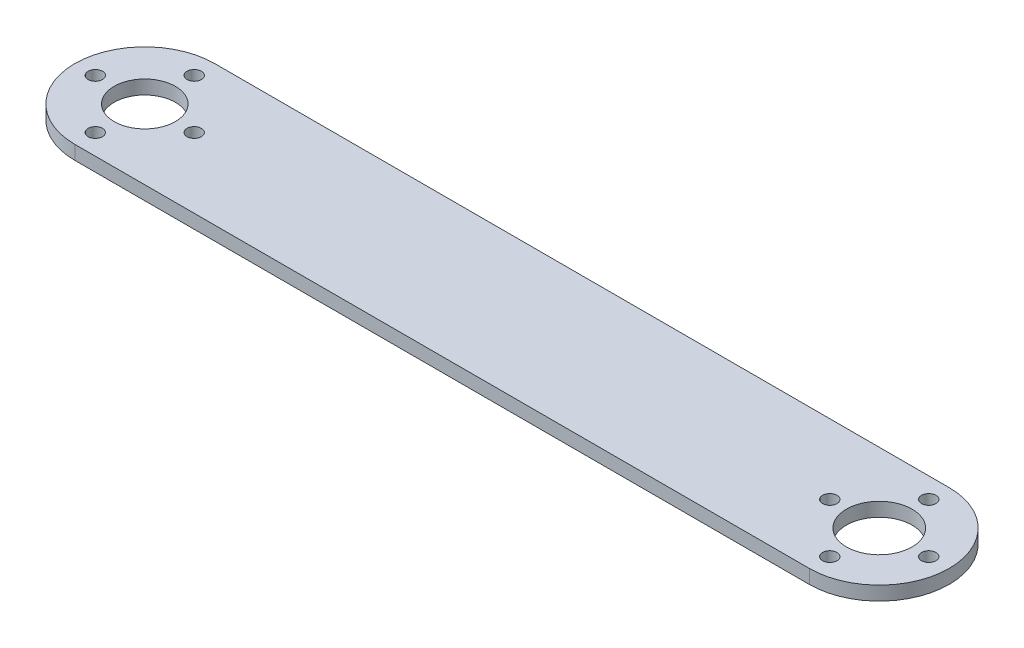
from build123d import *

# Parameters (mm, degrees)
SKETCH1_R           = 7
SKETCH1_R_2         = 7.5
BOSS_EXTRUDE1_DEPTH = 3.175
SKETCH2_R           = 1.65
CUT_EXTRUDE1_DEPTH  = 10


with BuildPart() as part:
    # Sketch1 → Boss-Extrude1 (new body)
    with BuildSketch(Plane(origin=(0, 0, 0), x_dir=(1, 0, 0), z_dir=(0, 1, 0))):
        with BuildLine():
            Line((0, 0), (168, 0))
            ThreePointArc((168, 0), (184, 16), (168, 32))
            Line((168, 32), (0, 32))
            ThreePointArc((0, 32), (-16, 16), (0, 0))
        make_face()
        with Locations(Location((0, 16, 0), (0, 0, 270))):
            Circle(SKETCH1_R, mode=Mode.SUBTRACT)
        with Locations(Location((168, 16, 0), (0, 0, 270))):
            Circle(SKETCH1_R_2, mode=Mode.SUBTRACT)
    extrude(amount=BOSS_EXTRUDE1_DEPTH)

    # Sketch2 → Cut-Extrude1 (cut)
    with BuildSketch(Plane(origin=(0, 3.175, 0), x_dir=(1, 0, 0), z_dir=(0, 1, 0))):
        with Locations(Location((156.686291501, 16, 0), (0, 0, 270))):
            Circle(SKETCH2_R)
        with Locations(Location((168, 27.313708499, 0), (0, 0, 270))):
            Circle(SKETCH2_R)
        with Locations(Location((-11.313708499, 16, 0), (0, 0, 270))):
            Circle(SKETCH2_R)
        with Locations(Location((0, 27.313708499, 0), (0, 0, 270))):
            Circle(SKETCH2_R)
        with Locations(Location((11.313708499, 16, 0), (0, 0, 270))):
            Circle(SKETCH2_R)
        with Locations(Location((0, 4.686291501, 0), (0, 0, 270))):
            Circle(SKETCH2_R)
        with Locations(Location((168, 4.686291501, 0), (0, 0, 270))):
            Circle(SKETCH2_R)
        with Locations(Location((179.313708499, 16, 0), (0, 0, 270))):
            Circle(SKETCH2_R)
    extrude(amount=-CUT_EXTRUDE1_DEPTH, mode=Mode.SUBTRACT)


solid = part.part
